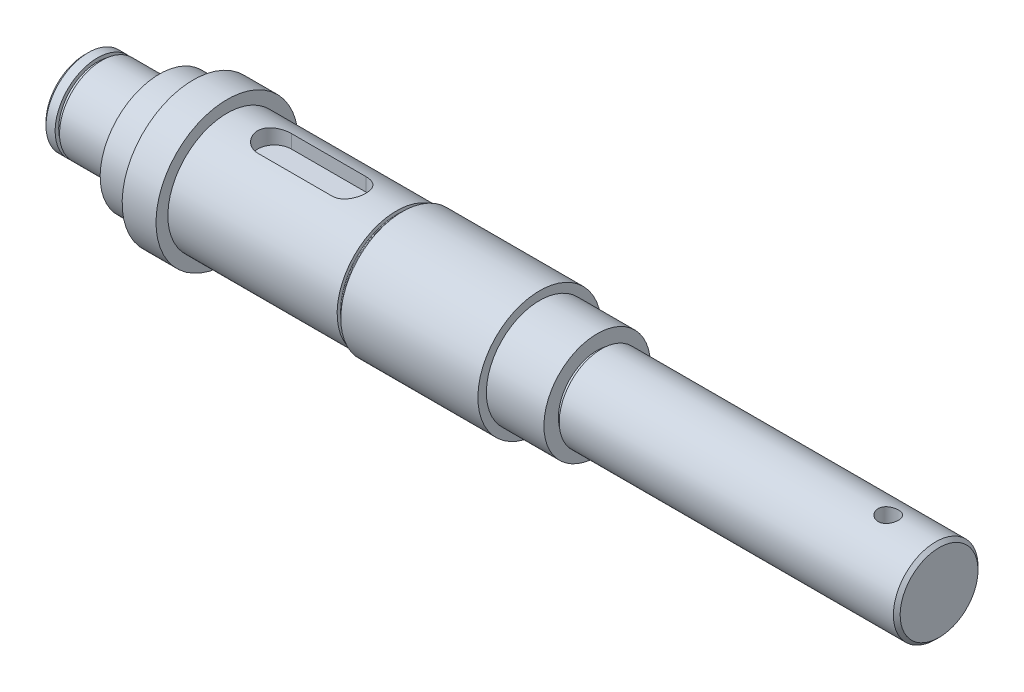
from build123d import *

# Parameters (mm, degrees)
CUT_EXTRUDE2_START = 18
CUT_EXTRUDE2_DEPTH = 5.2
SKETCH4_R          = 3
CUT_EXTRUDE3_DEPTH = 20


with BuildPart() as part:
    # Sketch1 → Revolve1 (revolve)
    with BuildSketch(Plane.XY):
        with BuildLine():
            Line((-4.185051691, 0), (-4.185051691, 11.5))
            Line((-4.185051691, 11.5), (-3.185051691, 12.5))
            Line((-3.185051691, 12.5), (-0.484378869, 12.5))
            Line((-0.484378869, 12.5), (-0.484378869, 11.45))
            Line((-0.484378869, 11.45), (0.815621131, 11.45))
            Line((0.815621131, 11.45), (0.815621131, 12.5))
            Line((0.815621131, 12.5), (17.814948309, 12.5))
            Line((17.814948309, 12.5), (17.814948309, 17.5))
            Line((17.814948309, 17.5), (27.814948309, 17.5))
            Line((27.814948309, 17.5), (27.814948309, 21))
            Line((27.814948309, 21), (37.814948309, 21))
            Line((37.814948309, 21), (37.814948309, 17.5))
            Line((37.814948309, 17.5), (87.814948309, 17.5))
            Line((87.814948309, 17.5), (87.916312777, 16.636677786))
            ThreePointArc((87.916312777, 16.636677786), (87.982028112, 16.510560309), (88.114948309, 16.46))
            Line((88.114948309, 16.46), (89.414948309, 16.46))
            ThreePointArc((89.414948309, 16.46), (89.978347351, 16.823399043), (89.614948309, 17.386798085))
            Line((89.614948309, 17.386798085), (89.614948309, 18.226798085))
            Line((89.614948309, 18.226798085), (130.114948309, 18.226798085))
            Line((130.114948309, 18.226798085), (130.114948309, 15.726798085))
            Line((130.114948309, 15.726798085), (147.114948309, 15.726798085))
            Line((147.114948309, 15.726798085), (147.114948309, 11.45))
            Line((147.114948309, 11.45), (148.414948309, 11.45))
            Line((148.414948309, 11.45), (148.414948309, 12.5))
            Line((148.414948309, 12.5), (247.114948309, 12.5))
            Line((247.114948309, 12.5), (248.114948309, 11.5))
            Line((248.114948309, 11.5), (248.114948309, 0))
            Line((248.114948309, 0), (-4.185051691, 0))
        make_face()
    revolve(axis=Axis((-15.310878374, 0, 0), (1, 0, 0)))

    # Sketch3 → Cut-Extrude2 (cut)
    with BuildSketch(Plane(origin=(0, 0, 0), x_dir=(1, 0, 0), z_dir=(0, 1, 0)).offset(CUT_EXTRUDE2_START)):
        with BuildLine():
            Line((51.814948309, 5), (73.814948309, 5))
            ThreePointArc((73.814948309, 5), (78.814948309, 0), (73.814948309, -5))
            Line((73.814948309, -5), (51.814948309, -5))
            ThreePointArc((51.814948309, -5), (46.814948309, 0), (51.814948309, 5))
        make_face()
    extrude(amount=-CUT_EXTRUDE2_DEPTH, mode=Mode.SUBTRACT)

    # Sketch4 → Cut-Extrude3 (cut, symmetric)
    with BuildSketch(Plane(origin=(0, 0, 0), x_dir=(1, 0, 0), z_dir=(0, 1, 0))):
        with Locations((233.114948309, 0)):
            Circle(SKETCH4_R)
    extrude(amount=CUT_EXTRUDE3_DEPTH, both=True, mode=Mode.SUBTRACT)


solid = part.part
